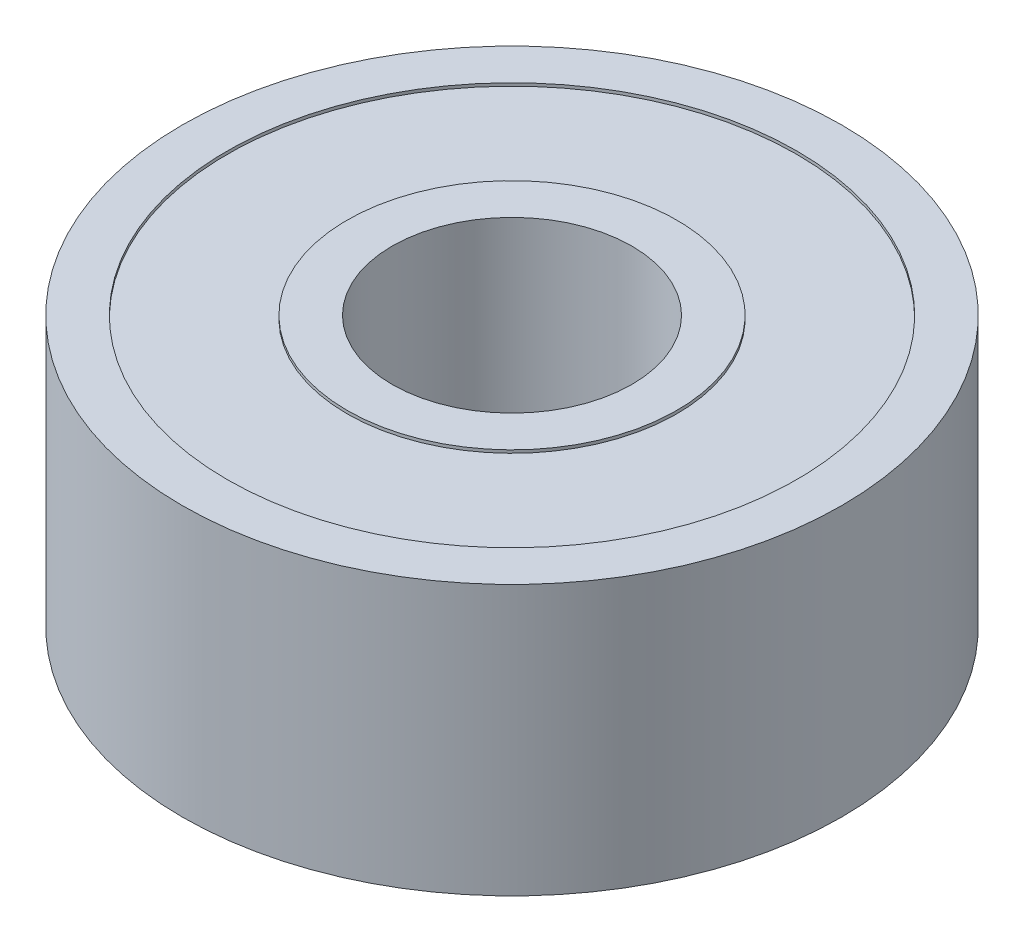
from build123d import *

# Parameters (mm, degrees)
SKETCH1_R           = 11
SKETCH1_R_2         = 4
BOSS_EXTRUDE1_DEPTH = 9
SKETCH2_R           = 9.5
SKETCH2_R_2         = 5.5
CUT_EXTRUDE1_DEPTH  = 0.1
CUT_EXTRUDE2_START  = -0.1
SKETCH3_R           = 9.5
SKETCH3_R_2         = 5.5
CUT_EXTRUDE2_DEPTH  = 0.1


with BuildPart() as part:
    # Sketch1 → Boss-Extrude1 (new body)
    with BuildSketch(Plane(origin=(0, 0, 0), x_dir=(1, 0, 0), z_dir=(0, 1, 0))):
        with Locations(Location((0, 0, 0), (0, 0, 270))):
            Circle(SKETCH1_R)
        with Locations(Location((0, 0, 0), (0, 0, 270))):
            Circle(SKETCH1_R_2, mode=Mode.SUBTRACT)
    extrude(amount=BOSS_EXTRUDE1_DEPTH)

    # Sketch2 → Cut-Extrude1 (cut)
    with BuildSketch(Plane(origin=(0, 9, 0), x_dir=(1, 0, 0), z_dir=(0, 1, 0))):
        with Locations(Location((0, 0, 0), (0, 0, 270))):
            Circle(SKETCH2_R)
        with Locations(Location((0, 0, 0), (0, 0, 270))):
            Circle(SKETCH2_R_2, mode=Mode.SUBTRACT)
    extrude(amount=-CUT_EXTRUDE1_DEPTH, mode=Mode.SUBTRACT)

    # Sketch3 → Cut-Extrude2 (cut)
    with BuildSketch(Plane.XZ.offset(CUT_EXTRUDE2_START)):
        with Locations(Location((0, 0, 0), (0, 0, 90))):
            Circle(SKETCH3_R)
        with Locations(Location((0, 0, 0), (0, 0, 90))):
            Circle(SKETCH3_R_2, mode=Mode.SUBTRACT)
    extrude(amount=CUT_EXTRUDE2_DEPTH, mode=Mode.SUBTRACT)


solid = part.part
